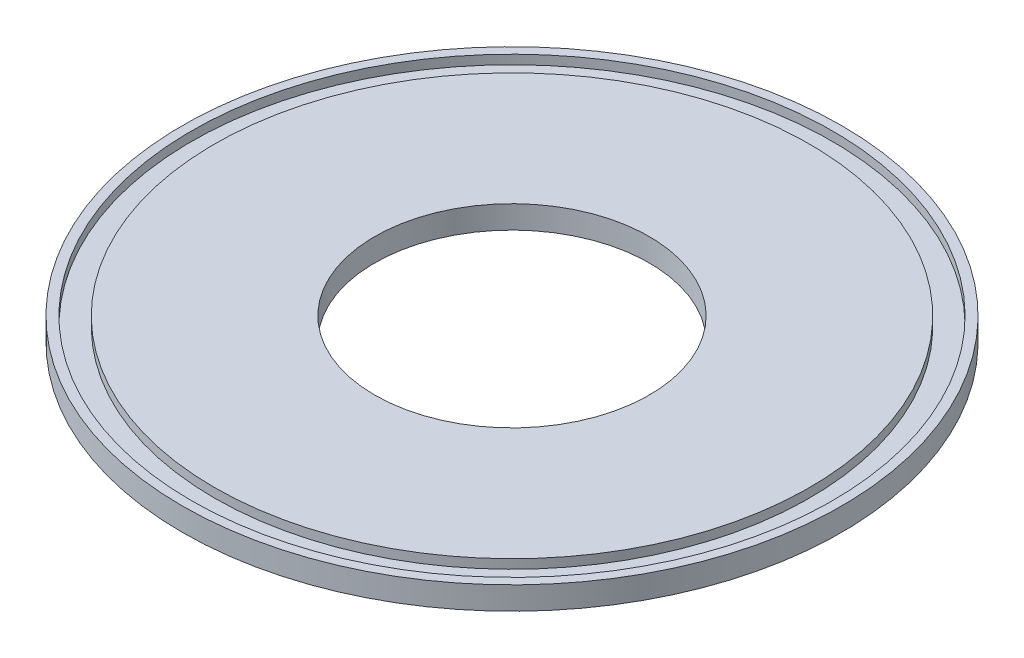
from build123d import *

# Parameters (mm, degrees)
SKETCH1_R           = 360
SKETCH1_R_2         = 150
BOSS_EXTRUDE1_DEPTH = 12.5
SKETCH2_R           = 350
SKETCH2_R_2         = 325
CUT_EXTRUDE1_DEPTH  = 10


with BuildPart() as part:
    # Sketch1 → Boss-Extrude1 (new, symmetric)
    with BuildSketch(Plane(origin=(0, 0, 0), x_dir=(1, 0, 0), z_dir=(0, 1, 0))):
        with Locations(Location((0, 0, 0), (0, 0, 270))):
            Circle(SKETCH1_R)
        with Locations(Location((0, 0, 0), (0, 0, 270))):
            Circle(SKETCH1_R_2, mode=Mode.SUBTRACT)
    extrude(amount=BOSS_EXTRUDE1_DEPTH, both=True)

    # Sketch2 → Cut-Extrude1 (cut)
    with BuildSketch(Plane(origin=(0, 12.5, 0), x_dir=(1, 0, 0), z_dir=(0, 1, 0))):
        with Locations(Location((0, 0, 0), (0, 0, 270))):
            Circle(SKETCH2_R)
        with Locations(Location((0, 0, 0), (0, 0, 270))):
            Circle(SKETCH2_R_2, mode=Mode.SUBTRACT)
    extrude(amount=-CUT_EXTRUDE1_DEPTH, mode=Mode.SUBTRACT)


solid = part.part
